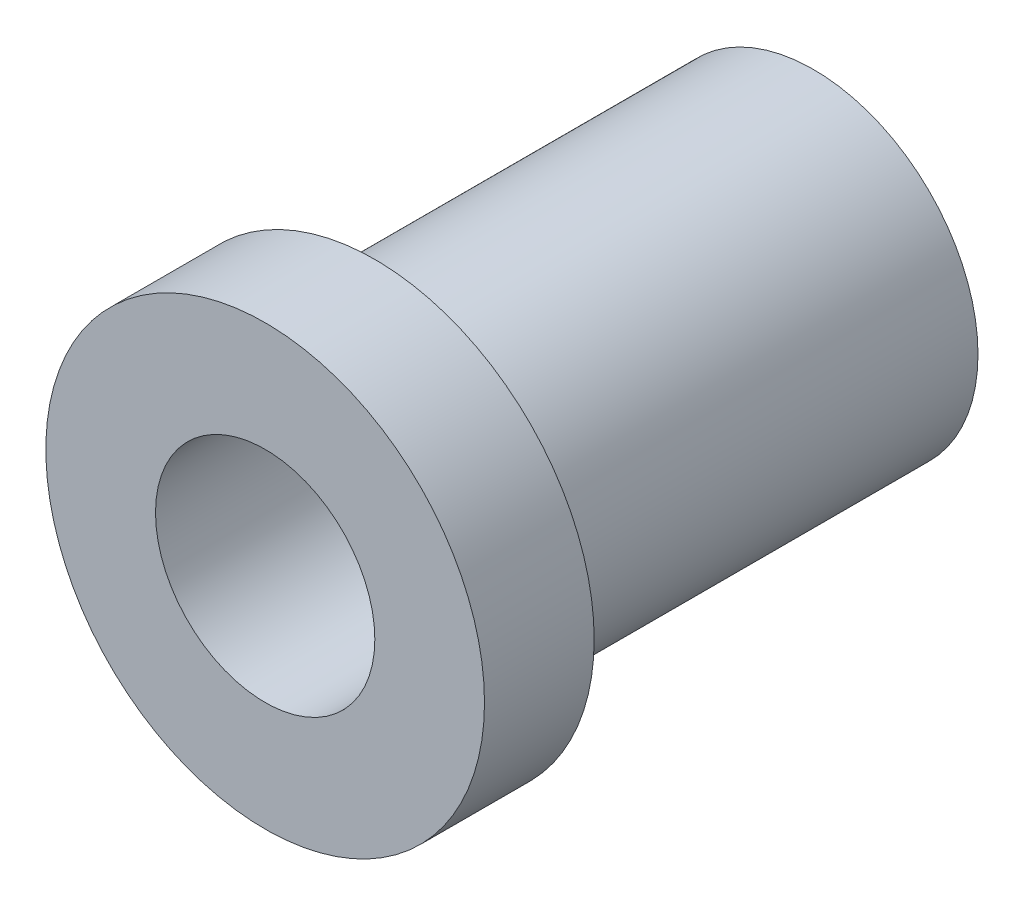
from build123d import *

# Parameters (mm, degrees)
SKETCH1_R           = 4
BOSS_EXTRUDE1_DEPTH = 2
SKETCH2_R           = 3
BOSS_EXTRUDE2_DEPTH = 8
SKETCH3_R           = 2
CUT_EXTRUDE1_DEPTH  = 8


with BuildPart() as part:
    # Sketch1 → Boss-Extrude1 (new body)
    with BuildSketch(Plane.XY):
        Circle(SKETCH1_R)
    extrude(amount=BOSS_EXTRUDE1_DEPTH)

    # Sketch2 → Boss-Extrude2 (add)
    with BuildSketch(Plane.XY):
        Circle(SKETCH2_R)
    extrude(amount=-BOSS_EXTRUDE2_DEPTH)

    # Sketch3 → Cut-Extrude1 (cut)
    with BuildSketch(Plane.XY.offset(2)):
        Circle(SKETCH3_R)
    extrude(amount=-CUT_EXTRUDE1_DEPTH, mode=Mode.SUBTRACT)


solid = part.part
